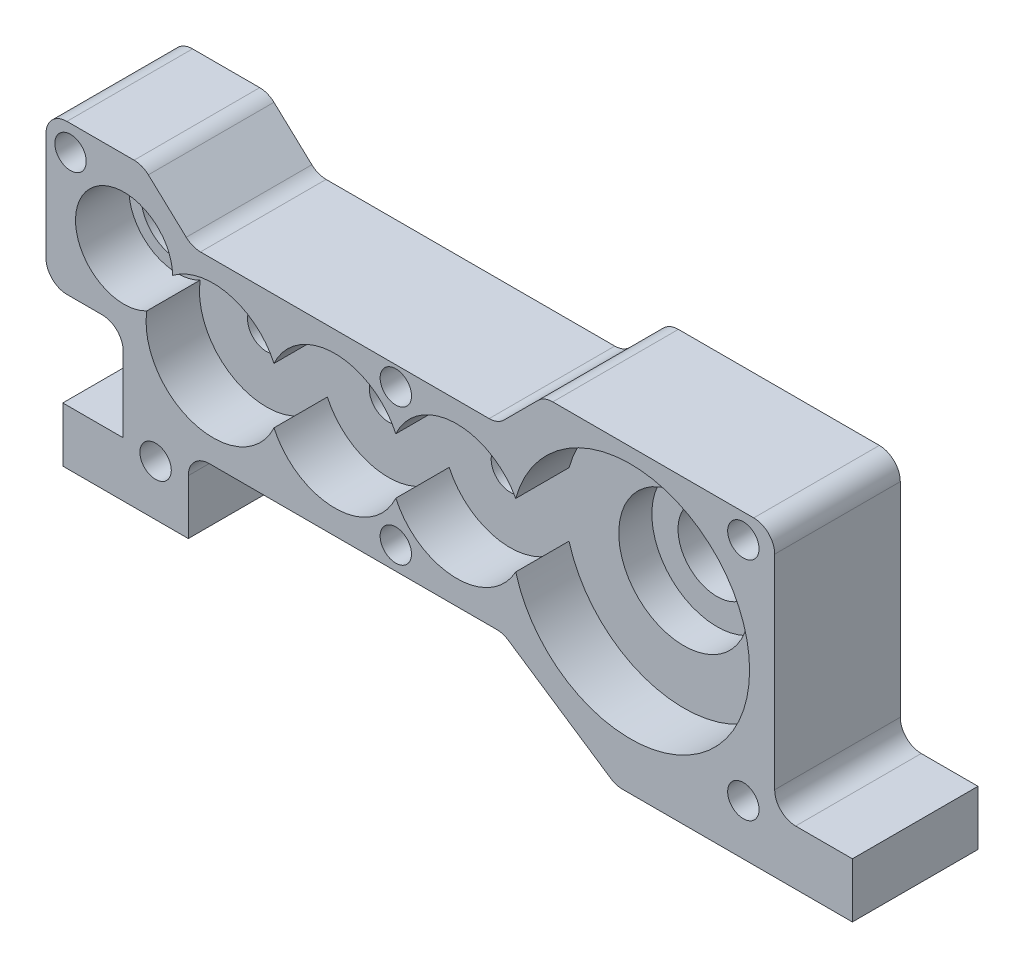
from build123d import *

# Parameters (mm, degrees)
EXTRUDE3_DEPTH = 15.24
EXTRUDE4_DEPTH = 6.477
SKETCH7_R      = 7.8994
EXTRUDE5_DEPTH = 4.0132
SKETCH8_R      = 2.2987
EXTRUDE6_DEPTH = 4.2926
SKETCH9_R      = 4.4196
EXTRUDE7_DEPTH = 4.4196
SKETCH12_R     = 1.179287719
SKETCH12_R_2   = 1.905
SKETCH12_R_3   = 4.7244
EXTRUDE8_DEPTH = 19.177


with BuildPart() as part:
    # Sketch4 → Extrude3 (new body)
    with BuildSketch(Plane.XY):
        with BuildLine():
            Line((-34.989977361, 16.714860485), (-26.837942516, 16.714860485))
            ThreePointArc((-26.837942516, 16.714860485), (-25.910547148, 16.539503762), (-25.11120297, 16.037646178))
            Line((-25.11120297, 16.037646178), (-20.513533707, 11.775761749))
            ThreePointArc((-20.513533707, 11.775761749), (-19.714189529, 11.273904165), (-18.786794161, 11.098547442))
            Line((-18.786794161, 11.098547442), (16.238704516, 11.098547442))
            ThreePointArc((16.238704516, 11.098547442), (17.210720434, 11.291893429), (18.03475574, 11.842496218))
            Line((18.03475574, 11.842496218), (22.163171231, 15.970911709))
            ThreePointArc((22.163171231, 15.970911709), (22.987206537, 16.521514497), (23.959222455, 16.714860485))
            Line((23.959222455, 16.714860485), (48.342712132, 16.714860485))
            ThreePointArc((48.342712132, 16.714860485), (50.138763356, 15.970911709), (50.882712132, 14.174860485))
            Line((50.882712132, 14.174860485), (50.882712132, -10.580714332))
            ThreePointArc((50.882712132, -10.580714332), (51.626660908, -12.376765556), (53.422712132, -13.120714332))
            Line((53.422712132, -13.120714332), (60.311539532, -13.120714332))
            Line((60.311539532, -13.120714332), (60.311539532, -19.76149571))
            Line((60.311539532, -19.76149571), (32.406215876, -19.76149571))
            ThreePointArc((32.406215876, -19.76149571), (31.669198311, -19.652216819), (30.995598433, -19.333783198))
            Line((30.995598433, -19.333783198), (18.568386733, -11.034703794))
            ThreePointArc((18.568386733, -11.034703794), (17.894786855, -10.716270173), (17.157769291, -10.606991282))
            Line((17.157769291, -10.606991282), (-17.723220352, -10.606991282))
            ThreePointArc((-17.723220352, -10.606991282), (-19.519271576, -11.350940058), (-20.263220352, -13.146991282))
            Line((-20.263220352, -13.146991282), (-20.263220352, -19.76149571))
            Line((-20.263220352, -19.76149571), (-35.4927874, -19.76149571))
            Line((-35.4927874, -19.76149571), (-35.4927874, -13.120714332))
            Line((-35.4927874, -13.120714332), (-28.163499743, -13.120714332))
            Line((-28.163499743, -13.120714332), (-28.163499743, -4.013214075))
            ThreePointArc((-28.163499743, -4.013214075), (-28.907448519, -2.217162851), (-30.703499743, -1.473214075))
            Line((-30.703499743, -1.473214075), (-34.989977361, -1.473214075))
            ThreePointArc((-34.989977361, -1.473214075), (-36.786028585, -0.729265299), (-37.529977361, 1.066785925))
            Line((-37.529977361, 1.066785925), (-37.529977361, 14.174860485))
            ThreePointArc((-37.529977361, 14.174860485), (-36.786028585, 15.970911709), (-34.989977361, 16.714860485))
        make_face()
    extrude(amount=-EXTRUDE3_DEPTH)

    # Sketch1 → Extrude4 (cut)
    with BuildSketch(Plane.XY):
        with BuildLine():
            ThreePointArc((19.458991626, 4.314801956), (12.038580445, 8.580199555), (4.913681626, 3.837633204))
            ThreePointArc((4.913681626, 3.837633204), (-2.477718374, 8.584569756), (-9.869118374, 3.837633204))
            ThreePointArc((-9.869118374, 3.837633204), (-15.272484602, 8.337693135), (-22.163825334, 6.939004858))
            ThreePointArc((-22.163825334, 6.939004858), (-33.125915624, 9.855374055), (-25.30153955, 1.642471287))
            ThreePointArc((-25.30153955, 1.642471287), (-19.566986279, -7.337311806), (-9.869118374, -2.924493692))
            ThreePointArc((-9.869118374, -2.924493692), (-2.477718374, -7.671430244), (4.913681626, -2.924493692))
            ThreePointArc((4.913681626, -2.924493692), (12.038580445, -7.667060044), (19.458991626, -3.401662445))
            ThreePointArc((19.458991626, -3.401662445), (47.839681626, 0.456569756), (19.458991626, 4.314801956))
        make_face()
    extrude(amount=-EXTRUDE4_DEPTH, mode=Mode.SUBTRACT)

    # Sketch7 → Extrude5 (cut)
    with BuildSketch(Plane.XY.offset(-6.477)):
        with Locations((33.387081626, 0.456569756)):
            Circle(SKETCH7_R)
    extrude(amount=-EXTRUDE5_DEPTH, mode=Mode.SUBTRACT)

    # Sketch8 → Extrude6 (cut)
    with BuildSketch(Plane.XY.offset(-6.477)):
        with Locations((12.305081626, 0.456569756)):
            Circle(SKETCH8_R)
        with Locations((-2.477718374, 0.456569756)):
            Circle(SKETCH8_R)
        with Locations((-17.260518374, 0.456569756)):
            Circle(SKETCH8_R)
    extrude(amount=-EXTRUDE6_DEPTH, mode=Mode.SUBTRACT)

    # Sketch9 → Extrude7 (cut)
    with BuildSketch(Plane.XY.offset(-6.477)):
        with Locations((-28.055981517, 6.851899403)):
            Circle(SKETCH9_R)
    extrude(amount=-EXTRUDE7_DEPTH, mode=Mode.SUBTRACT)

    # Sketch12 → Extrude8 (cut, symmetric)
    with BuildSketch(Plane.XY):
        with Locations((-28.055981517, 6.851899403)):
            Circle(SKETCH12_R)
        with Locations((-24.233740004, -13.623099256)):
            Circle(SKETCH12_R_2)
        with Locations((47.080626595, -13.623099256)):
            Circle(SKETCH12_R_2)
        with Locations((47.080626595, 13.774579835)):
            Circle(SKETCH12_R_2)
        with Locations((33.387081626, 0.456569756)):
            Circle(SKETCH12_R_3)
        with Locations((4.913681626, -7.85150728)):
            Circle(SKETCH12_R_2)
        with Locations((4.913681626, 8.764646791)):
            Circle(SKETCH12_R_2)
        with Locations((-34.554939326, 13.665214221)):
            Circle(SKETCH12_R_2)
    extrude(amount=EXTRUDE8_DEPTH, both=True, mode=Mode.SUBTRACT)


solid = part.part
